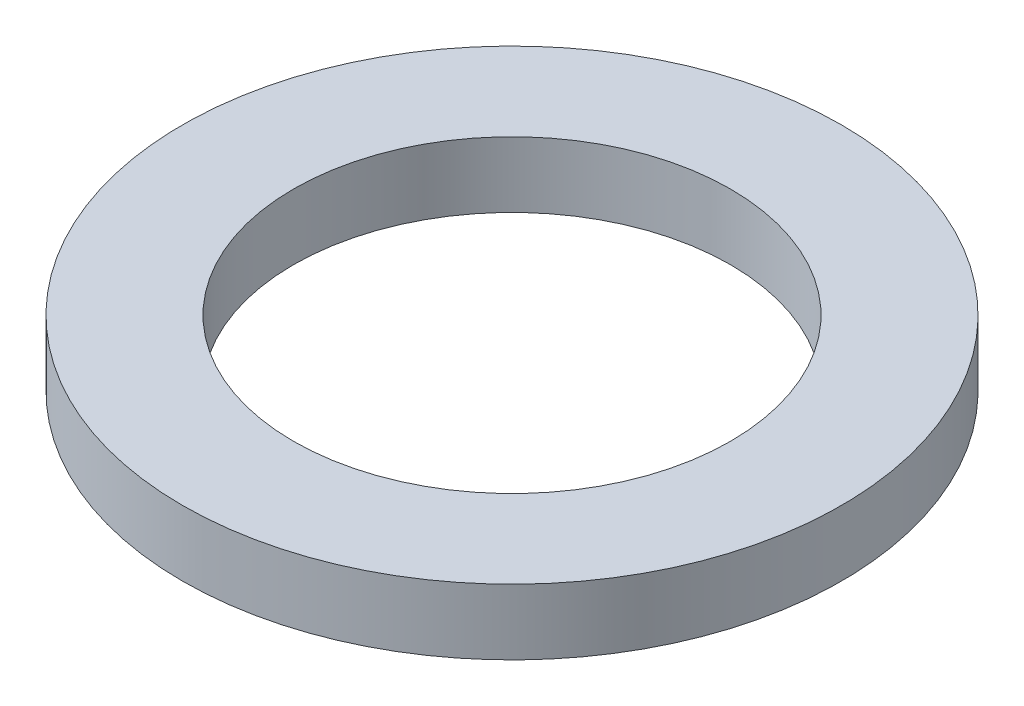
from build123d import *

# Parameters (mm, degrees)
SKETCH1_R           = 3.76906403
SKETCH1_R_2         = 2.49906403
BOSS_EXTRUDE1_DEPTH = 0.75


with BuildPart() as part:
    # Sketch1 → Boss-Extrude1 (new body)
    with BuildSketch(Plane(origin=(0, 0, 0), x_dir=(1, 0, 0), z_dir=(0, 1, 0))):
        with Locations(Location((0, 0, 0), (0, 0, 270))):
            Circle(SKETCH1_R)
        with Locations(Location((0, 0, 0), (0, 0, 270))):
            Circle(SKETCH1_R_2, mode=Mode.SUBTRACT)
    extrude(amount=BOSS_EXTRUDE1_DEPTH)


solid = part.part
